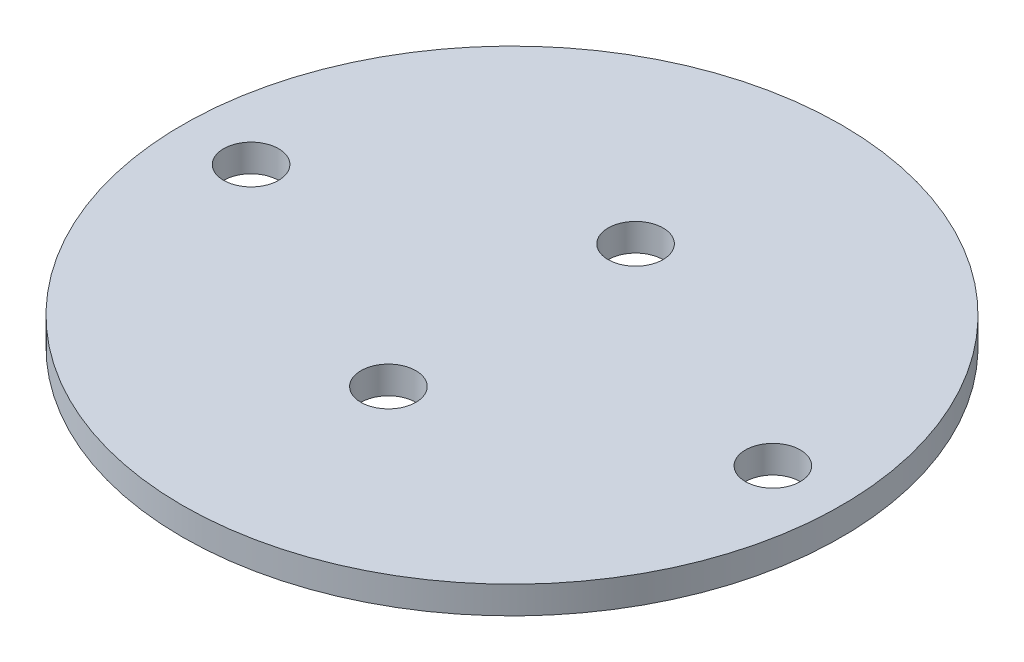
from build123d import *

# Parameters (mm, degrees)
SKETCH1_R           = 36
SKETCH1_R_2         = 3
BOSS_EXTRUDE1_DEPTH = 3


with BuildPart() as part:
    # Sketch1 → Boss-Extrude1 (new body)
    with BuildSketch(Plane(origin=(0, 0, 0), x_dir=(1, 0, 0), z_dir=(0, 1, 0))):
        with Locations(Location((3.941504792, 0, 0), (0, 0, 270))):
            Circle(SKETCH1_R)
        with Locations(Location((32.441504792, 0, 0), (0, 0, 270))):
            Circle(SKETCH1_R_2, mode=Mode.SUBTRACT)
        with Locations(Location((-24.558495208, 0, 0), (0, 0, 270))):
            Circle(SKETCH1_R_2, mode=Mode.SUBTRACT)
        with Locations(Location((3.941504792, 13.5, 0), (0, 0, 270))):
            Circle(SKETCH1_R_2, mode=Mode.SUBTRACT)
        with Locations(Location((3.941504792, -13.5, 0), (0, 0, 270))):
            Circle(SKETCH1_R_2, mode=Mode.SUBTRACT)
    extrude(amount=-BOSS_EXTRUDE1_DEPTH)


solid = part.part
